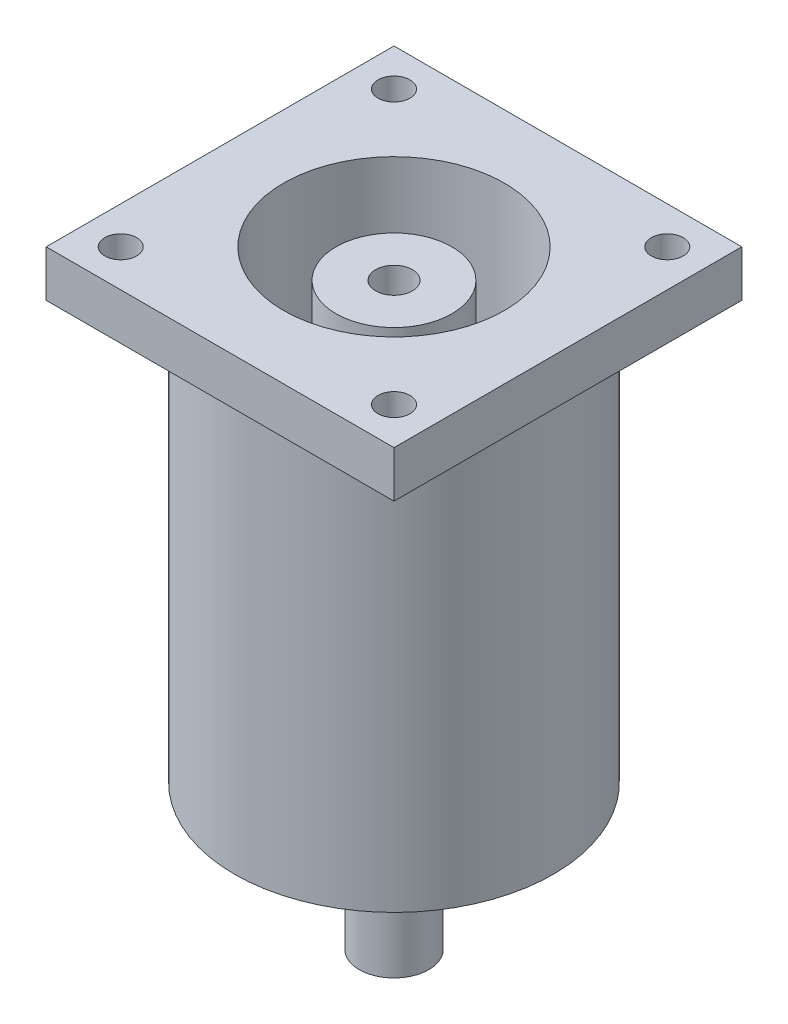
from build123d import *

# Parameters (mm, degrees)
SKETCH1_R           = 27.5
BOSS_EXTRUDE1_DEPTH = 72
SKETCH2_R           = 16
BOSS_EXTRUDE2_DEPTH = 2.5
SKETCH3_W           = 60
SKETCH3_H           = 60
BOSS_EXTRUDE3_DEPTH = 8
SKETCH4_R           = 6
BOSS_EXTRUDE4_DEPTH = 22.5
SKETCH5_R           = 2
CUT_EXTRUDE1_DEPTH  = 16
SKETCH6_R           = 19.05
CUT_EXTRUDE2_DEPTH  = 25
SKETCH7_R           = 10
SKETCH7_R_2         = 3.175
BOSS_EXTRUDE5_DEPTH = 20
SKETCH8_R           = 2.75
CUT_EXTRUDE3_DEPTH  = 10


with BuildPart() as part:
    # Sketch1 → Boss-Extrude1 (new body)
    with BuildSketch(Plane(origin=(0, 0, 0), x_dir=(1, 0, 0), z_dir=(0, 1, 0))):
        with Locations(Location((0, 0, 0), (0, 0, 270))):
            Circle(SKETCH1_R)
    extrude(amount=BOSS_EXTRUDE1_DEPTH)

    # Sketch2 → Boss-Extrude2 (add)
    with BuildSketch(Plane.XZ):
        with Locations(Location((0, 0, 0), (0, 0, 270))):
            Circle(SKETCH2_R)
    extrude(amount=BOSS_EXTRUDE2_DEPTH)

    # Sketch3 → Boss-Extrude3 (add)
    with BuildSketch(Plane(origin=(0, 72, 0), x_dir=(1, 0, 0), z_dir=(0, 1, 0))):
        Rectangle(SKETCH3_W, SKETCH3_H)
    extrude(amount=BOSS_EXTRUDE3_DEPTH)

    # Sketch4 → Boss-Extrude4 (add)
    with BuildSketch(Plane(origin=(0, -2.5, 0), x_dir=(-1, 0, 0), z_dir=(0, -1, 0))):
        with Locations(Location((0, 0, 0), (0, 0, 270))):
            Circle(SKETCH4_R)
    extrude(amount=BOSS_EXTRUDE4_DEPTH)

    # Sketch5 → Cut-Extrude1 (cut)
    with BuildSketch(Plane.XZ):
        with Locations(Location((14.142135624, 14.142135624, 0), (0, 0, 270))):
            Circle(SKETCH5_R)
        with Locations(Location((14.142135624, -14.142135624, 0), (0, 0, 270))):
            Circle(SKETCH5_R)
        with Locations(Location((-14.142135624, -14.142135624, 0), (0, 0, 270))):
            Circle(SKETCH5_R)
        with Locations(Location((-14.142135624, 14.142135624, 0), (0, 0, 270))):
            Circle(SKETCH5_R)
    extrude(amount=-CUT_EXTRUDE1_DEPTH, mode=Mode.SUBTRACT)

    # Sketch6 → Cut-Extrude2 (cut)
    with BuildSketch(Plane(origin=(0, 80, 0), x_dir=(1, 0, 0), z_dir=(0, 1, 0))):
        with Locations(Location((0, 0, 0), (0, 0, 270))):
            Circle(SKETCH6_R)
    extrude(amount=-CUT_EXTRUDE2_DEPTH, mode=Mode.SUBTRACT)

    # Sketch7 → Boss-Extrude5 (add)
    with BuildSketch(Plane(origin=(0, 55, 0), x_dir=(1, 0, 0), z_dir=(0, 1, 0))):
        with Locations(Location((0, 0, 0), (0, 0, 270))):
            Circle(SKETCH7_R)
        with Locations(Location((0, 0, 0), (0, 0, 270))):
            Circle(SKETCH7_R_2, mode=Mode.SUBTRACT)
    extrude(amount=BOSS_EXTRUDE5_DEPTH)

    # Sketch8 → Cut-Extrude3 (cut)
    with BuildSketch(Plane(origin=(0, 80, 0), x_dir=(1, 0, 0), z_dir=(0, 1, 0))):
        with Locations(Location((-23.571404551, 23.571404551, 0), (0, 0, 270))):
            Circle(SKETCH8_R)
        with Locations(Location((23.571404551, 23.571404551, 0), (0, 0, 270))):
            Circle(SKETCH8_R)
        with Locations(Location((23.571404551, -23.571404551, 0), (0, 0, 270))):
            Circle(SKETCH8_R)
        with Locations(Location((-23.571404551, -23.571404551, 0), (0, 0, 270))):
            Circle(SKETCH8_R)
    extrude(amount=-CUT_EXTRUDE3_DEPTH, mode=Mode.SUBTRACT)


solid = part.part
